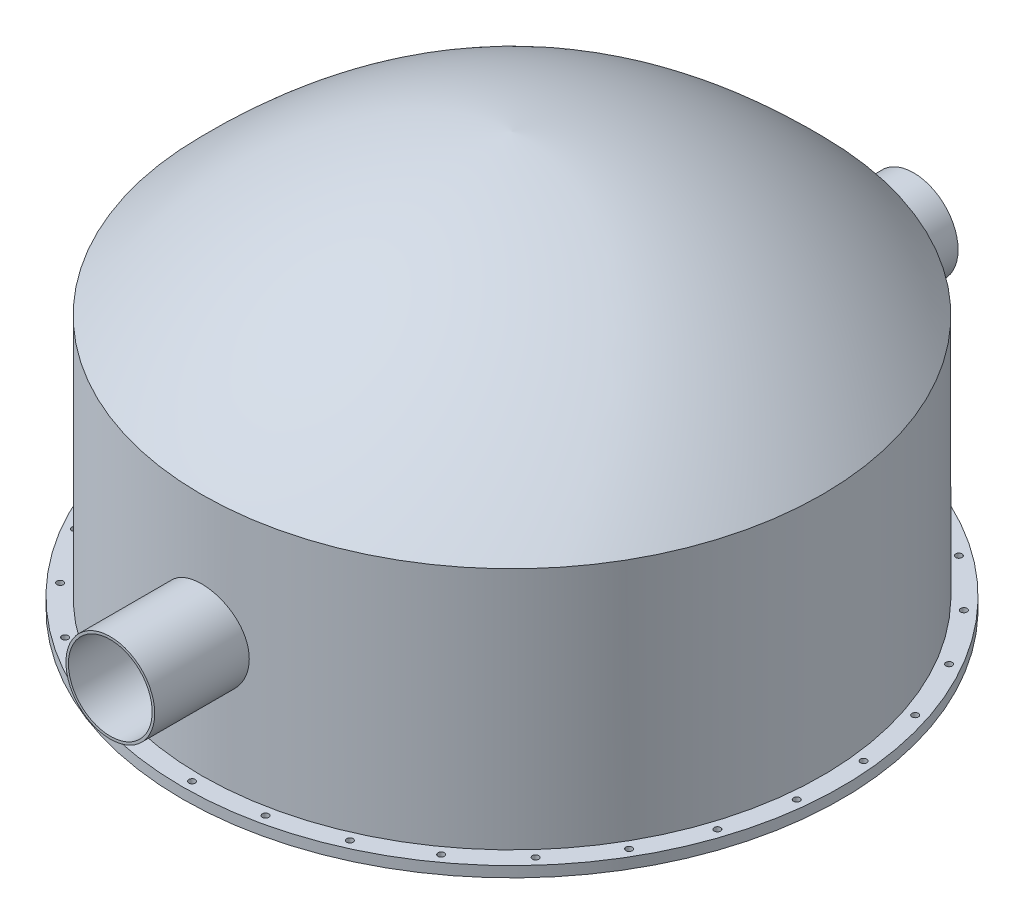
from build123d import *

# Parameters (mm, degrees)
SKETCH5_R           = 304.8
BOSS_EXTRUDE1_DEPTH = 740
SKETCH6_R           = 287.4
CUT_EXTRUDE2_DEPTH  = 10000
SKETCH7_R           = 2056.6885
CUT_EXTRUDE3_DEPTH  = 1400
CUT_EXTRUDE4_START  = -1300
SKETCH9_R           = 2081.1295
CUT_EXTRUDE4_DEPTH  = 1300
SKETCH11_R          = 22
CUT_EXTRUDE5_DEPTH  = 500


with BuildPart() as part:
    # Sketch2 → Revolve3 (revolve)
    with BuildSketch(Plane(origin=(0, 0, 0), x_dir=(0, 0, -1), z_dir=(1, 0, 0))):
        with BuildLine():
            Line((-2081.1295, -171.115), (-2081.1295, 0))
            add(Edge.make_bspline(
                [(-2081.1295, 0), (-1041.865159808, 973.906904547), (0, 1044.41)],
                knots=[0, 0, 0, 1, 1, 1], degree=2))
            Line((0, 1044.41), (0, 1093.3))
            add(Edge.make_bspline(
                [(-2130.0195, 0), (-1162.828995464, 997.365117244), (0, 1093.3)],
                knots=[0, 0, 0, 0.82450401, 0.82450401, 0.82450401], degree=2))
            Line((-2130.0195, 0), (-2130.0195, -171.115))
            Line((-2130.0195, -171.115), (-2130.0195, -1671.115))
            Line((-2130.0195, -1671.115), (-2262.0195, -1671.115))
            Line((-2262.0195, -1671.115), (-2262.0195, -1744.115))
            Line((-2262.0195, -1744.115), (-2081.1295, -1744.115))
            Line((-2081.1295, -1744.115), (-2081.1295, -171.115))
        make_face()
    revolve(axis=Axis((0, 1093.3, 0), (0, -1, 0)))

    # Sketch5 → Boss-Extrude1 (add)
    with BuildSketch(Plane.XY.offset(-2757)):
        with Locations(Location((0, -835.5575, 0), (0, 0, 180))):
            Circle(SKETCH5_R)
    boss_extrude1 = extrude(amount=BOSS_EXTRUDE1_DEPTH)

    # Mirror1: Boss-Extrude1 across plane
    add(boss_extrude1.mirror(Plane.XY))

    # Sketch6 → Cut-Extrude2 (cut)
    with BuildSketch(Plane.XY.offset(-2757)):
        with Locations(Location((0, -835.5575, 0), (0, 0, 180))):
            Circle(SKETCH6_R)
    extrude(amount=CUT_EXTRUDE2_DEPTH, mode=Mode.SUBTRACT)

    # Sketch7 → Cut-Extrude3 (cut)
    with BuildSketch(Plane.XZ.offset(1744.115)):
        Circle(SKETCH7_R)
    extrude(amount=-CUT_EXTRUDE3_DEPTH, mode=Mode.SUBTRACT)

    # Sketch9 → Cut-Extrude4 (cut)
    with BuildSketch(Plane.XZ.offset(1744.115).offset(CUT_EXTRUDE4_START)):
        with Locations(Location((0, 0, 0), (0, 0, 90))):
            Circle(SKETCH9_R)
    extrude(amount=CUT_EXTRUDE4_DEPTH, mode=Mode.SUBTRACT)

    # Sketch11 → Cut-Extrude5 (cut)
    with BuildSketch(Plane.XZ.offset(1744.115)):
        with Locations(Location((0, 2196.0195, 0), (0, 0, 270))):
            Circle(SKETCH11_R)
        with Locations(Location((456.578127314, 2148.03120509, 0), (0, 0, 270))):
            Circle(SKETCH11_R)
        with Locations(Location((893.201599559, 2006.16363912, 0), (0, 0, 270))):
            Circle(SKETCH11_R)
        with Locations(Location((1290.787875847, 1776.617095479, 0), (0, 0, 270))):
            Circle(SKETCH11_R)
        with Locations(Location((1631.960528072, 1469.423859611, 0), (0, 0, 270))):
            Circle(SKETCH11_R)
        with Locations(Location((1901.808674206, 1098.00975, 0), (0, 0, 270))):
            Circle(SKETCH11_R)
        with Locations(Location((2088.538655386, 678.607345479, 0), (0, 0, 270))):
            Circle(SKETCH11_R)
        with Locations(Location((2183.989475406, 229.546543641, 0), (0, 0, 270))):
            Circle(SKETCH11_R)
        with Locations(Location((2183.989475406, -229.546543641, 0), (0, 0, 270))):
            Circle(SKETCH11_R)
        with Locations(Location((2088.538655386, -678.607345479, 0), (0, 0, 270))):
            Circle(SKETCH11_R)
        with Locations(Location((1901.808674206, -1098.00975, 0), (0, 0, 270))):
            Circle(SKETCH11_R)
        with Locations(Location((1631.960528072, -1469.423859611, 0), (0, 0, 270))):
            Circle(SKETCH11_R)
        with Locations(Location((1290.787875847, -1776.617095479, 0), (0, 0, 270))):
            Circle(SKETCH11_R)
        with Locations(Location((893.201599559, -2006.16363912, 0), (0, 0, 270))):
            Circle(SKETCH11_R)
        with Locations(Location((456.578127314, -2148.03120509, 0), (0, 0, 270))):
            Circle(SKETCH11_R)
        with Locations(Location((0, -2196.0195, 0), (0, 0, 270))):
            Circle(SKETCH11_R)
        with Locations(Location((-456.578127314, -2148.03120509, 0), (0, 0, 270))):
            Circle(SKETCH11_R)
        with Locations(Location((-893.201599559, -2006.16363912, 0), (0, 0, 270))):
            Circle(SKETCH11_R)
        with Locations(Location((-1290.787875847, -1776.617095479, 0), (0, 0, 270))):
            Circle(SKETCH11_R)
        with Locations(Location((-1631.960528072, -1469.423859611, 0), (0, 0, 270))):
            Circle(SKETCH11_R)
        with Locations(Location((-1901.808674206, -1098.00975, 0), (0, 0, 270))):
            Circle(SKETCH11_R)
        with Locations(Location((-2088.538655386, -678.607345479, 0), (0, 0, 270))):
            Circle(SKETCH11_R)
        with Locations(Location((-2183.989475406, -229.546543641, 0), (0, 0, 270))):
            Circle(SKETCH11_R)
        with Locations(Location((-2183.989475406, 229.546543641, 0), (0, 0, 270))):
            Circle(SKETCH11_R)
        with Locations(Location((-2088.538655386, 678.607345479, 0), (0, 0, 270))):
            Circle(SKETCH11_R)
        with Locations(Location((-1901.808674206, 1098.00975, 0), (0, 0, 270))):
            Circle(SKETCH11_R)
        with Locations(Location((-1631.960528072, 1469.423859611, 0), (0, 0, 270))):
            Circle(SKETCH11_R)
        with Locations(Location((-1290.787875847, 1776.617095479, 0), (0, 0, 270))):
            Circle(SKETCH11_R)
        with Locations(Location((-893.201599559, 2006.16363912, 0), (0, 0, 270))):
            Circle(SKETCH11_R)
        with Locations(Location((-456.578127314, 2148.03120509, 0), (0, 0, 270))):
            Circle(SKETCH11_R)
    extrude(amount=-CUT_EXTRUDE5_DEPTH, mode=Mode.SUBTRACT)


solid = part.part
